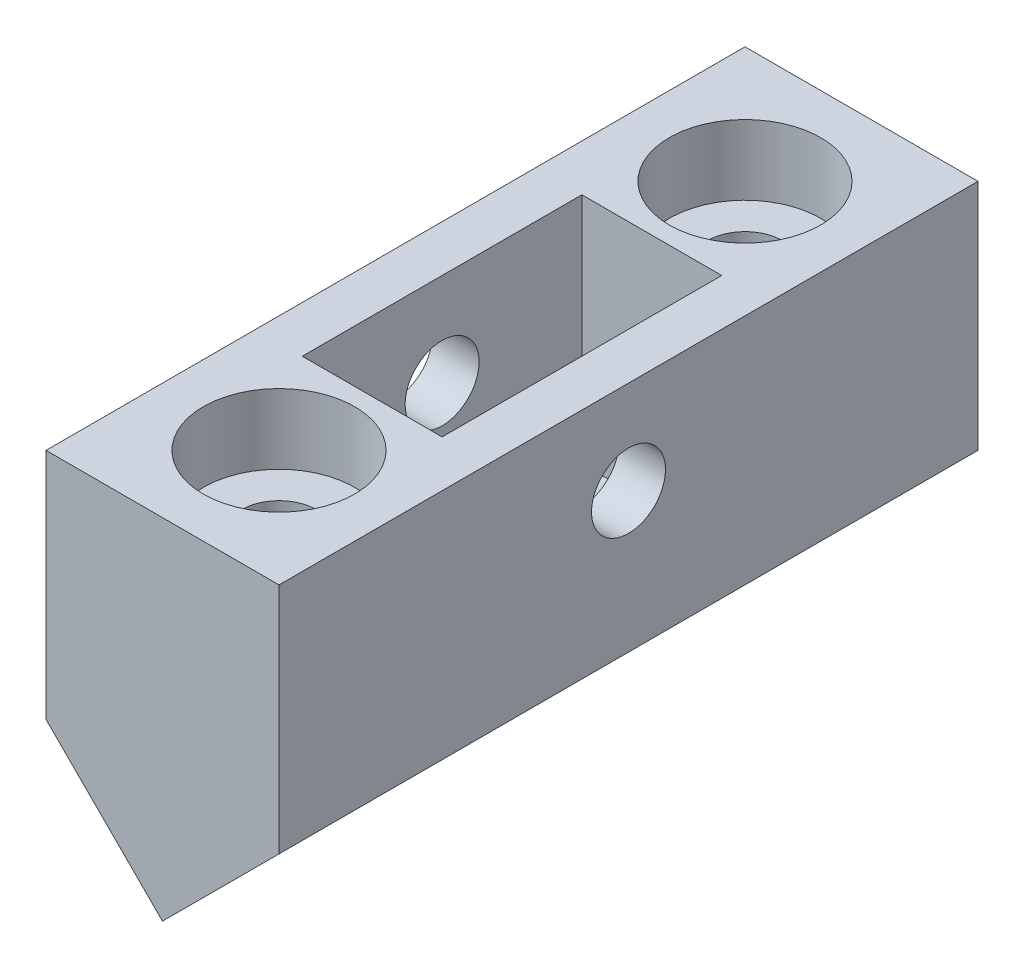
from build123d import *

# Parameters (mm, degrees)
BOSS_EXTRUDE1_DEPTH            = 15
BOSS_EXTRUDE1_DEPTH_BACK       = 15
SKETCH2_W                      = 6
SKETCH2_H                      = 12
CUT_EXTRUDE1_DEPTH             = 10
SKETCH3_R                      = 1.5875
CUT_EXTRUDE2_DEPTH             = 21.615528128
CBORE_FOR_M3_SHCS1_D           = 3.2
CBORE_FOR_M3_SHCS1_CBORE_D     = 6.5
CBORE_FOR_M3_SHCS1_CBORE_DEPTH = 3


with BuildPart() as part:
    # Sketch1 → Boss-Extrude1 (new, two sides: drawn at the far end of the back side and taken through both)
    with BuildSketch(Plane.XY.offset(-BOSS_EXTRUDE1_DEPTH_BACK)):
        Polygon((-5, 5), (5, 5), (5, -5), (0, -10), (-5, -5), align=None)
    extrude(amount=BOSS_EXTRUDE1_DEPTH + BOSS_EXTRUDE1_DEPTH_BACK)

    # Sketch2 → Cut-Extrude1 (cut)
    with BuildSketch(Plane(origin=(0, 5, 0), x_dir=(1, 0, 0), z_dir=(0, 1, 0))):
        Rectangle(SKETCH2_W, SKETCH2_H)
    extrude(amount=-CUT_EXTRUDE1_DEPTH, mode=Mode.SUBTRACT)

    # Sketch3 → Cut-Extrude2 (cut, through all)
    with BuildSketch(Plane(origin=(5, 0, 0), x_dir=(0, 0, -1), z_dir=(1, 0, 0))):
        with Locations((0, 1)):
            Circle(SKETCH3_R)
    extrude(amount=-CUT_EXTRUDE2_DEPTH, mode=Mode.SUBTRACT)

    # CBORE for M3 SHCS1 (through all)
    with Locations(Plane(origin=(0, 5, 0), x_dir=(1, 0, 0), z_dir=(0, 1, 0))):
        with Locations((0, -10), (0, 10)):
            CounterBoreHole(CBORE_FOR_M3_SHCS1_D / 2, CBORE_FOR_M3_SHCS1_CBORE_D / 2, CBORE_FOR_M3_SHCS1_CBORE_DEPTH)


solid = part.part
